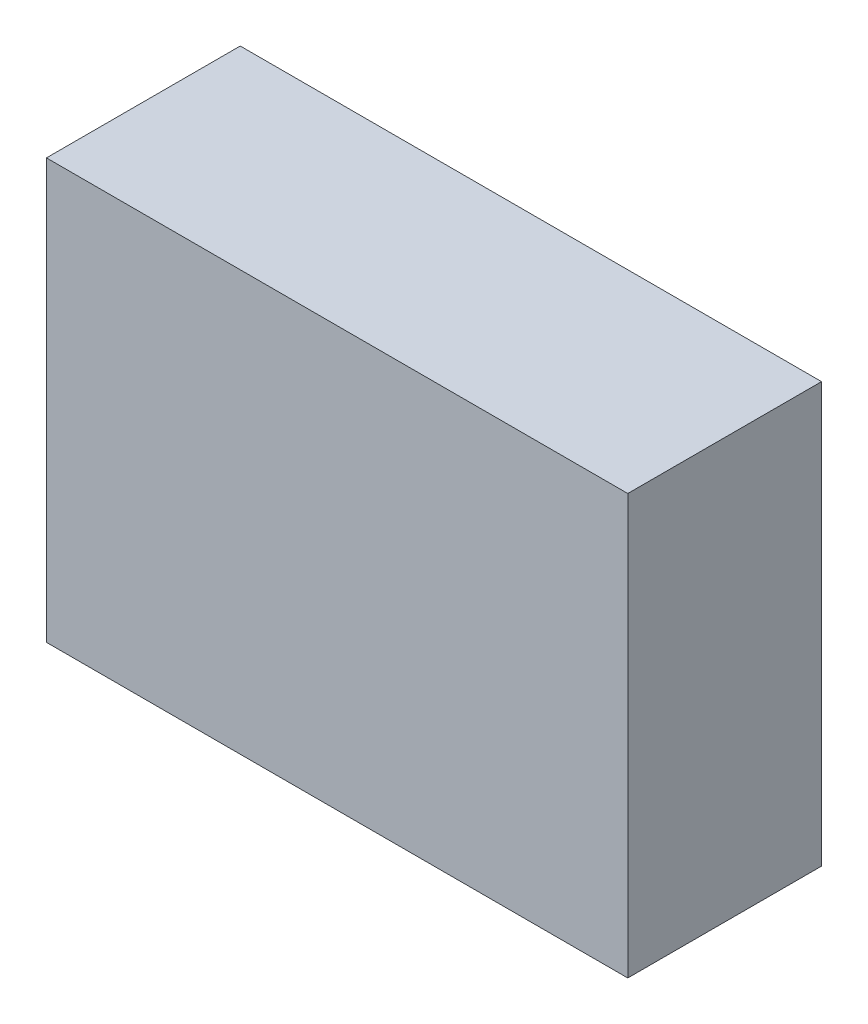
from build123d import *

# Parameters (mm, degrees)
SKETCH1_W           = 7.62
SKETCH1_H           = 2.54
BOSS_EXTRUDE1_DEPTH = 5.5


with BuildPart() as part:
    # Sketch1 → Boss-Extrude1 (new body)
    with BuildSketch(Plane(origin=(0, 0, 0), x_dir=(1, 0, 0), z_dir=(0, 1, 0))):
        Rectangle(SKETCH1_W, SKETCH1_H)
    extrude(amount=BOSS_EXTRUDE1_DEPTH)


solid = part.part
